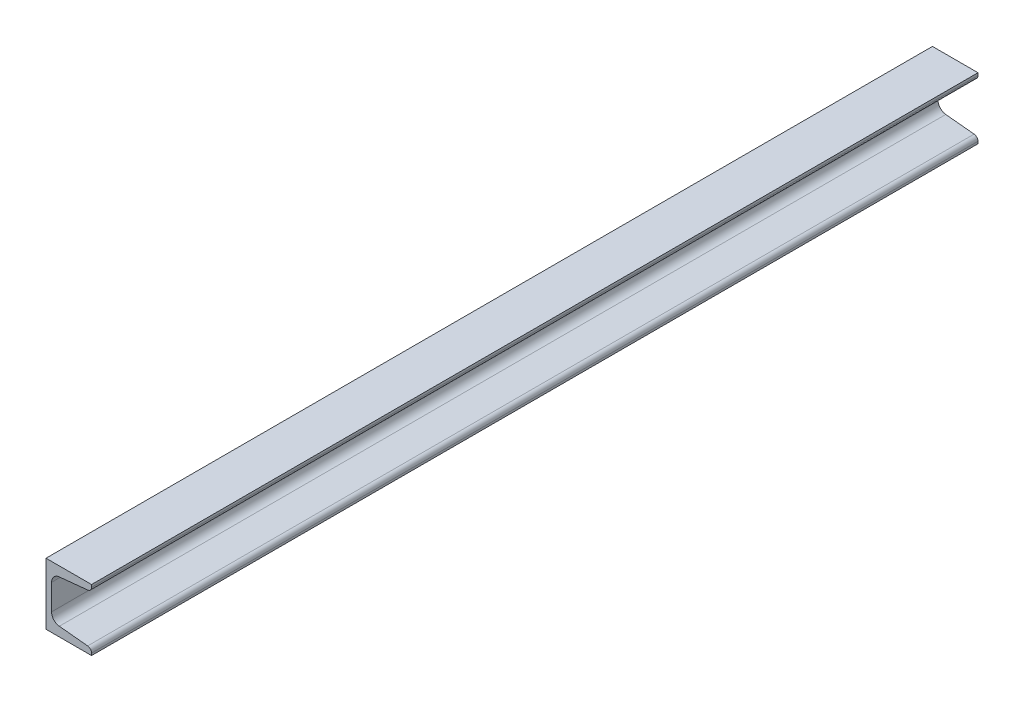
from build123d import *

# Parameters (mm, degrees)
EXTRUDE_1_DEPTH = 720


with BuildPart() as part:
    # 草图1 → 凸台-拉伸1 (new body)
    with BuildSketch(Plane.XY):
        with BuildLine():
            Line((0, 0), (0, 50))
            Line((0, 50), (37, 50))
            Line((37, 50), (37, 48.040012398))
            ThreePointArc((37, 48.040012398), (36.095083867, 45.691493776), (33.848263017, 44.557382233))
            Line((33.848263017, 44.557382233), (10.803473967, 42.252903328))
            ThreePointArc((10.803473967, 42.252903328), (6.309832265, 39.984680242), (4.5, 35.287642996))
            Line((4.5, 35.287642996), (4.5, 14.509912935))
            ThreePointArc((4.5, 14.509912935), (6.309832265, 9.812875689), (10.803473967, 7.544652603))
            Line((10.803473967, 7.544652603), (33.848263017, 5.240173698))
            ThreePointArc((33.848263017, 5.240173698), (36.095083867, 4.106062155), (37, 1.757543533))
            Line((37, 1.757543533), (37, 0))
            Line((37, 0), (0, 0))
        make_face()
    extrude(amount=EXTRUDE_1_DEPTH)


solid = part.part
